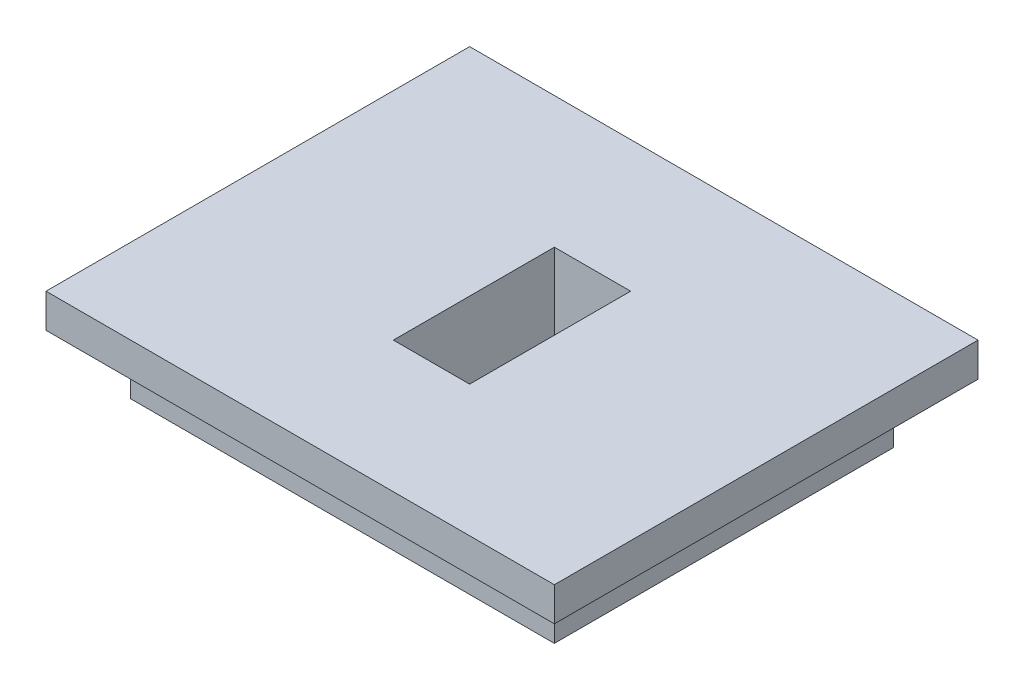
from build123d import *

# Parameters (mm, degrees)
SKETCH1_W           = 60
SKETCH1_H           = 50
BOSS_EXTRUDE1_DEPTH = 4
SKETCH2_W           = 50
SKETCH2_H           = 40
BOSS_EXTRUDE2_DEPTH = 7
SKETCH3_W           = 9
SKETCH3_H           = 19
CUT_EXTRUDE1_DEPTH  = 14


with BuildPart() as part:
    # Sketch1 → Boss-Extrude1 (new body)
    with BuildSketch(Plane(origin=(0, 0, 0), x_dir=(1, 0, 0), z_dir=(0, 1, 0))):
        Rectangle(SKETCH1_W, SKETCH1_H)
    extrude(amount=BOSS_EXTRUDE1_DEPTH)

    # Sketch2 → Boss-Extrude2 (add)
    with BuildSketch(Plane(origin=(0, 0, 0), x_dir=(-1, 0, 0), z_dir=(0, -1, 0))):
        Rectangle(SKETCH2_W, SKETCH2_H)
    extrude(amount=BOSS_EXTRUDE2_DEPTH)

    # Sketch3 → Cut-Extrude1 (cut)
    with BuildSketch(Plane(origin=(0, 4, 0), x_dir=(1, 0, 0), z_dir=(0, 1, 0))):
        Rectangle(SKETCH3_W, SKETCH3_H)
    extrude(amount=-CUT_EXTRUDE1_DEPTH, mode=Mode.SUBTRACT)


solid = part.part
